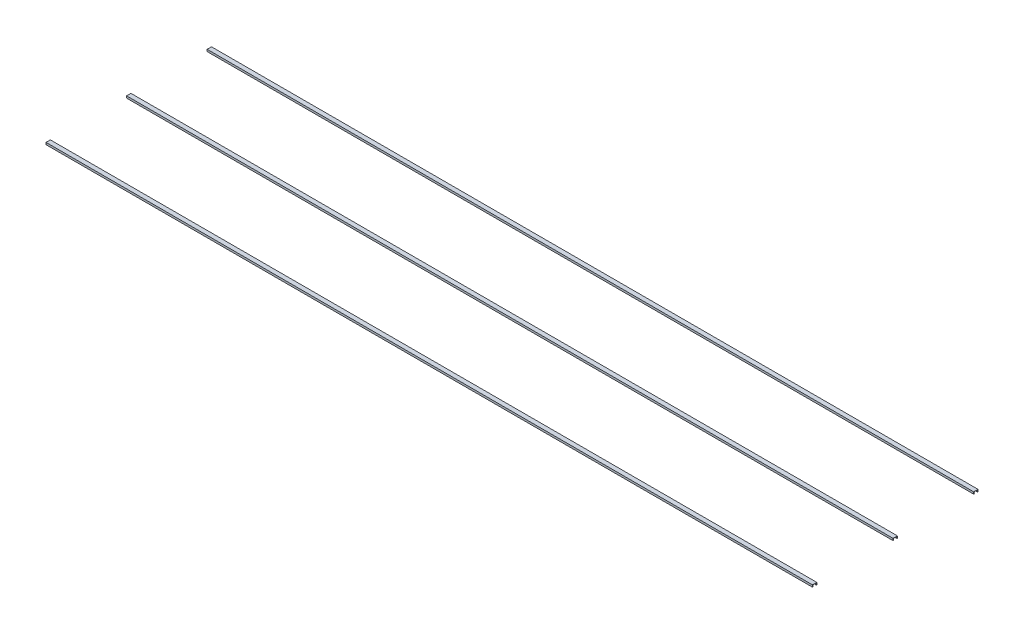
from build123d import *

# Parameters (mm, degrees)
BOSS_EXTRUDE1_DEPTH = 2530


with BuildPart() as part:
    # Sketch1 → Boss-Extrude1 (new body)
    with BuildSketch(Plane(origin=(0, 0, 0), x_dir=(0, 0, -1), z_dir=(1, 0, 0))):
        Polygon((-260.85, 0), (-258.85, 0), (-258.85, 3.35), (-273.15, 3.35), (-273.15, -3.35), (-271.15, -3.35), (-271.15, -2.023201375), (-271.95, -2.023201375), (-271.95, -0.781470196), (-271.15, -0.781470196), (-271.15, 0.276300808), (-271.95, 0.276300808), (-271.95, 2.391842816), (-260.05, 2.391842816), (-260.05, 0.276300808), (-260.85, 0.276300808), align=None)
        Polygon((-7.15, 0), (-5.15, 0), (-5.15, 0.276300808), (-5.95, 0.276300808), (-5.95, 2.391842816), (5.95, 2.391842816), (5.95, 0.276300808), (5.15, 0.276300808), (5.15, 0), (7.15, 0), (7.15, 3.35), (-7.15, 3.35), align=None)
        Polygon((7.15, 0), (5.15, 0), (5.15, -0.781470196), (5.95, -0.781470196), (5.95, -2.023201375), (5.15, -2.023201375), (5.15, -3.35), (7.15, -3.35), align=None)
        Polygon((-5.15, -0.781470196), (-5.15, 0), (-7.15, 0), (-7.15, -3.35), (-5.15, -3.35), (-5.15, -2.023201375), (-5.95, -2.023201375), (-5.95, -0.781470196), align=None)
        Polygon((258.85, 3.35), (258.85, 0), (260.85, 0), (260.85, 0.276300808), (260.05, 0.276300808), (260.05, 2.391842816), (271.95, 2.391842816), (271.95, 0.276300808), (271.15, 0.276300808), (271.15, -0.781470196), (271.95, -0.781470196), (271.95, -2.023201375), (271.15, -2.023201375), (271.15, -3.35), (273.15, -3.35), (273.15, 3.35), align=None)
        Polygon((260.85, 0), (258.85, 0), (258.85, -3.35), (260.85, -3.35), (260.85, -2.023201375), (260.05, -2.023201375), (260.05, -0.781470196), (260.85, -0.781470196), align=None)
        Polygon((-258.85, -3.35), (-258.85, 0), (-260.85, 0), (-260.85, -0.781470196), (-260.05, -0.781470196), (-260.05, -2.023201375), (-260.85, -2.023201375), (-260.85, -3.35), align=None)
    extrude(amount=BOSS_EXTRUDE1_DEPTH)


solid = part.part
